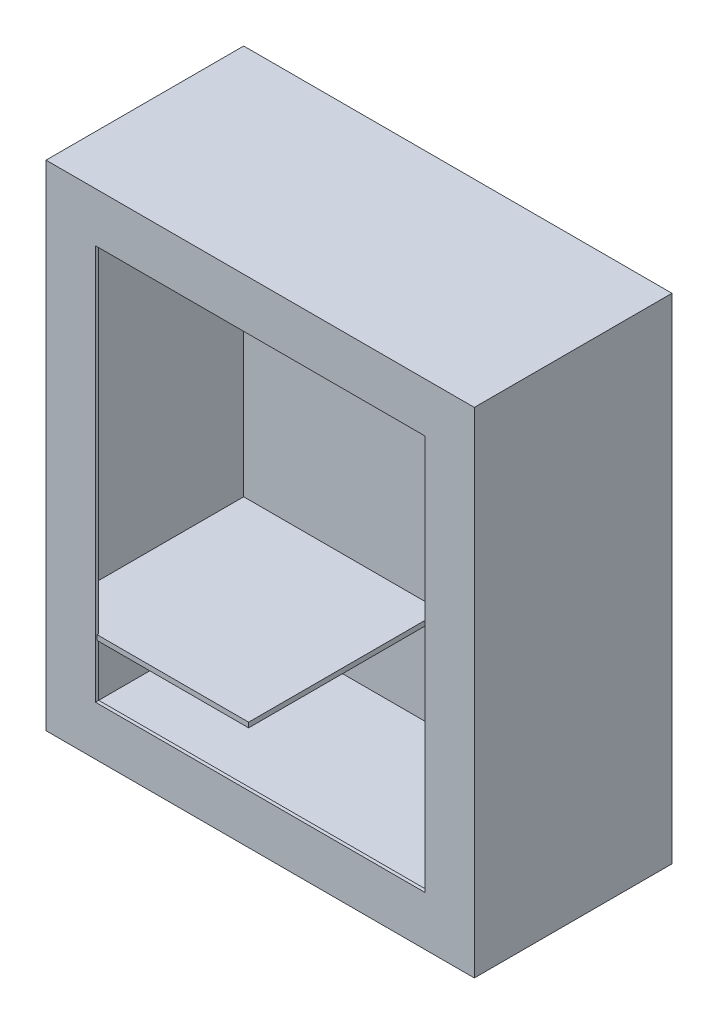
from build123d import *

# Parameters (mm, degrees)
CROQUIS2_W              = 260
CROQUIS2_H              = 300
SALIENTE_EXTRUIR1_DEPTH = 120
CROQUIS3_W              = 200
CROQUIS3_H              = 240
CORTAR_EXTRUIR2_DEPTH   = 2
CROQUIS4_W              = 256
CROQUIS4_H              = 296
CORTAR_EXTRUIR3_DEPTH   = 116
CROQUIS6_W              = 117
CROQUIS6_H              = 3
SALIENTE_EXTRUIR2_DEPTH = 120


with BuildPart() as part:
    # Croquis2 → Saliente-Extruir1 (new body)
    with BuildSketch(Plane.XY):
        Rectangle(CROQUIS2_W, CROQUIS2_H)
    extrude(amount=SALIENTE_EXTRUIR1_DEPTH)

    # Croquis3 → Cortar-Extruir2 (cut)
    with BuildSketch(Plane.XY.offset(120)):
        Rectangle(CROQUIS3_W, CROQUIS3_H)
    extrude(amount=-CORTAR_EXTRUIR2_DEPTH, mode=Mode.SUBTRACT)

    # Croquis4 → Cortar-Extruir3 (cut)
    with BuildSketch(Plane.XY.offset(118)):
        Rectangle(CROQUIS4_W, CROQUIS4_H)
    extrude(amount=-CORTAR_EXTRUIR3_DEPTH, mode=Mode.SUBTRACT)

    # Croquis6 → Saliente-Extruir2 (add)
    with BuildSketch(Plane(origin=(-128, 0, 0), x_dir=(0, 0, -1), z_dir=(1, 0, 0))):
        with Locations((-60.5, -86.5)):
            Rectangle(CROQUIS6_W, CROQUIS6_H)
    extrude(amount=SALIENTE_EXTRUIR2_DEPTH)


solid = part.part
